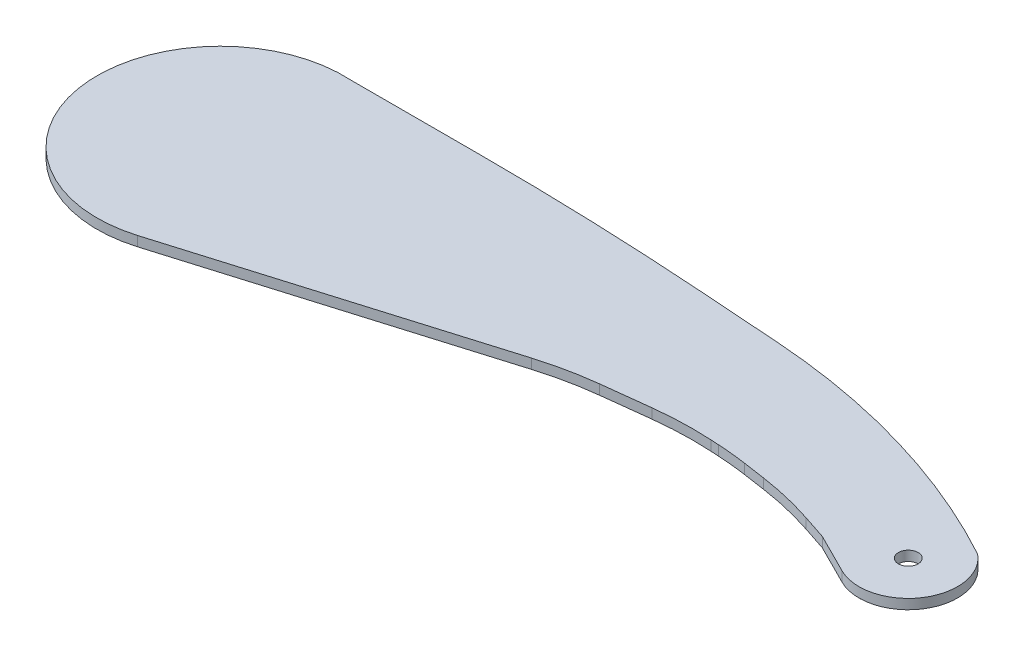
from build123d import *

# Parameters (mm, degrees)
SKETCH_3_R          = 3
EXTRUDE_3_DEPTH     = 3
CUT_EXTRUDE_1_DEPTH = 232.050692133


with BuildPart() as part:
    # 草图3 → 凸台-拉伸3 (new body)
    with BuildSketch(Plane(origin=(0, 0, 0), x_dir=(1, 0, 0), z_dir=(0, 1, 0))):
        with BuildLine():
            Line((41.250352709, 37.437096955), (2.1711222, 37.437096955))
            ThreePointArc((2.1711222, 37.437096955), (-37.245354745, -4.362745688), (10.764053756, -35.921931278))
            Line((10.764053756, -35.921931278), (102.964763311, -8.293867902))
            ThreePointArc((102.964763311, -8.293867902), (111.422798179, -6.156653751), (120.034918159, -4.764738657))
            Line((120.034918159, -4.764738657), (134.438707225, -3.077546548))
            ThreePointArc((134.438707225, -3.077546548), (143.139368882, -2.441523824), (151.862354927, -2.566233988))
            Line((151.862354927, -2.566233988), (154.274717881, -2.706136256))
            ThreePointArc((154.274717881, -2.706136256), (158.623829365, -3.053695832), (162.953641123, -3.590630188))
            Line((162.953641123, -3.590630188), (169.76623366, -4.586797783))
            ThreePointArc((169.76623366, -4.586797783), (178.335042253, -6.22434395), (186.728522391, -8.602479637))
            Line((186.728522391, -8.602479637), (194.174928436, -11.067895146))
            Line((194.174928436, -11.067895146), (206.234258671, -17.125709257))
            ThreePointArc((206.234258671, -17.125709257), (225.560310545, -11.871725652), (222.437509756, 7.910810586))
            Line((222.437509756, 7.910810586), (215.500702076, 12.589746446))
            ThreePointArc((215.500702076, 12.589746446), (200.255076036, 21.040534955), (183.773601289, 26.715561818))
            Line((183.773601289, 26.715561818), (174.440874355, 29.042471985))
            ThreePointArc((174.440874355, 29.042471985), (165.892131299, 30.781733417), (157.22433217, 31.769304384))
            Line((157.22433217, 31.769304384), (111.006826453, 35.001147214))
            ThreePointArc((111.006826453, 35.001147214), (76.149849411, 36.827923974), (41.250352709, 37.437096955))
        make_face()
        with Locations(Location((212.967480872, -3.721839712, 0), (0, 0, 270))):
            Circle(SKETCH_3_R, mode=Mode.SUBTRACT)
    extrude(amount=EXTRUDE_3_DEPTH)

    # 草图4 → 切除-拉伸1 (cut, through all)
    with BuildSketch(Plane(origin=(0, 3, 0), x_dir=(1, 0, 0), z_dir=(0, 1, 0))):
        with BuildLine():
            ThreePointArc((136.159607467, 33.242293427), (180.670295505, 25.248626767), (222.437509756, 7.910810586))
            Line((222.437509756, 7.910810586), (215.500702076, 12.589746446))
            ThreePointArc((215.500702076, 12.589746446), (200.255076036, 21.040534955), (183.773601289, 26.715561818))
            Line((183.773601289, 26.715561818), (174.440874355, 29.042471985))
            ThreePointArc((174.440874355, 29.042471985), (165.892131299, 30.781733417), (157.22433217, 31.769304384))
            Line((157.22433217, 31.769304384), (136.159607467, 33.242293427))
        make_face()
    extrude(amount=-CUT_EXTRUDE_1_DEPTH, mode=Mode.SUBTRACT)


solid = part.part
